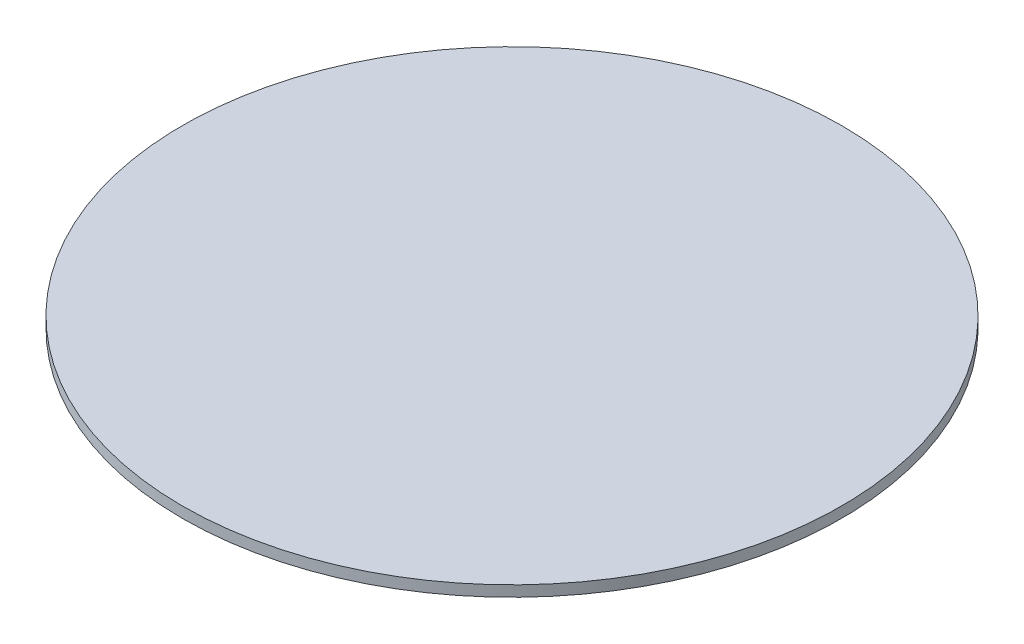
from build123d import *

# Parameters (mm, degrees)
SKETCH1_R           = 305
BOSS_EXTRUDE1_DEPTH = 10


with BuildPart() as part:
    # Sketch1 → Boss-Extrude1 (new body)
    with BuildSketch(Plane(origin=(0, 0, 0), x_dir=(1, 0, 0), z_dir=(0, 1, 0))):
        with Locations(Location((0, 0, 0), (0, 0, 270))):
            Circle(SKETCH1_R)
    extrude(amount=BOSS_EXTRUDE1_DEPTH)


solid = part.part
